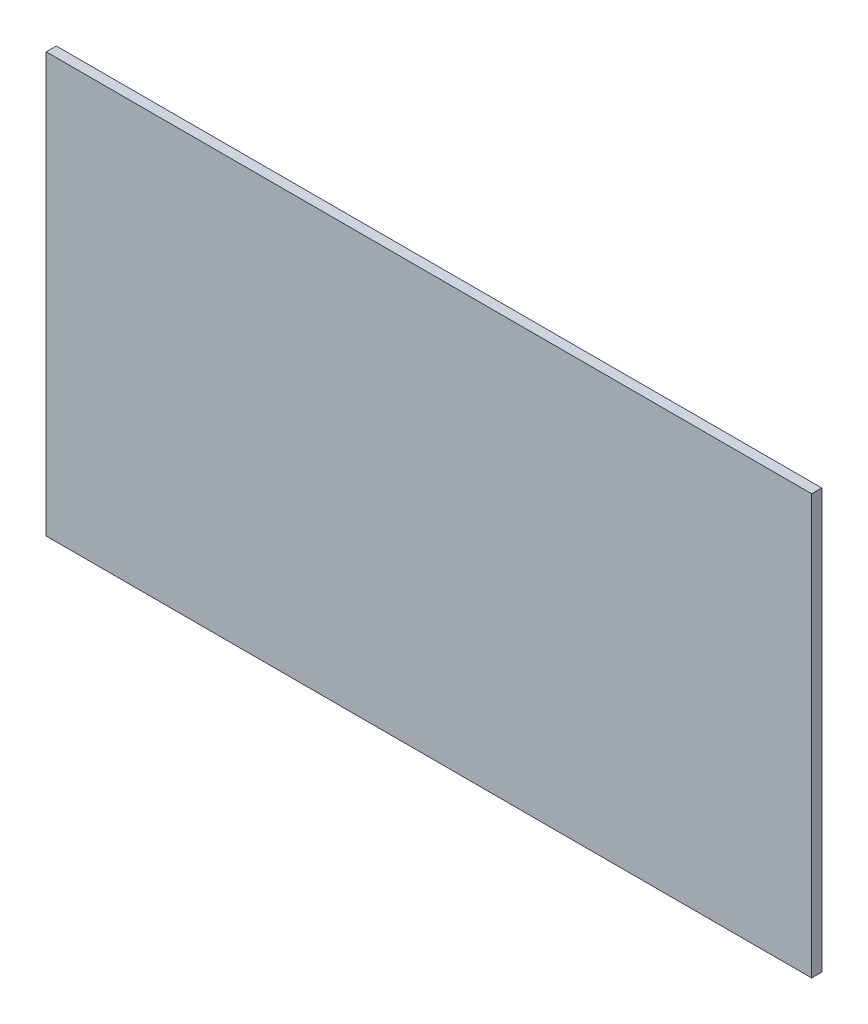
from build123d import *

# Parameters (mm, degrees)
SKETCH_1_W      = 151.5
SKETCH_1_H      = 83
EXTRUDE_1_DEPTH = 2


with BuildPart() as part:
    # 草图1 → 凸台-拉伸1 (new body)
    with BuildSketch(Plane.XY):
        with Locations((75.75, 41.5)):
            Rectangle(SKETCH_1_W, SKETCH_1_H)
    extrude(amount=EXTRUDE_1_DEPTH)


solid = part.part
